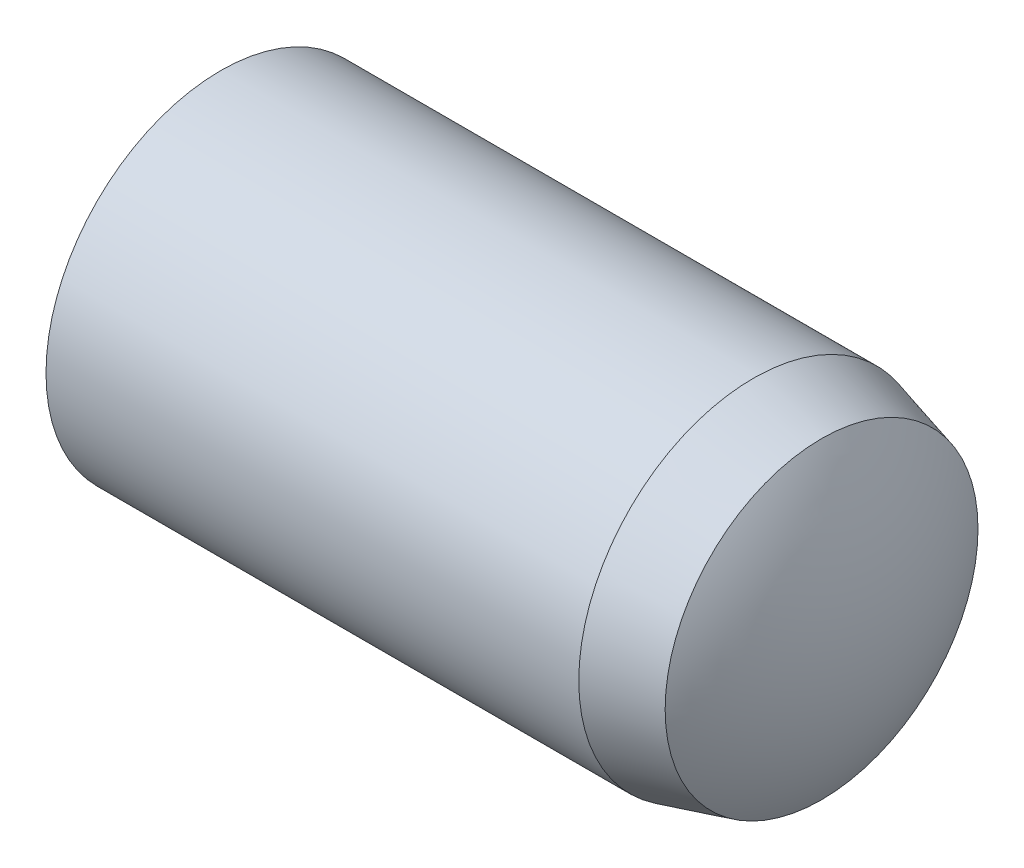
from build123d import *

# Parameters (mm, degrees)
EXTRUDE1_DEPTH      = 8
EXTRUDE1_DEPTH_BACK = 8
SKETCH2_R           = 4


with BuildPart() as part:
    # Sketch2 → Extrude1 (new, two sides: drawn at the far end of the back side and taken through both)
    with BuildSketch(Plane(origin=(0, 0, 0), x_dir=(0, 0, -1), z_dir=(1, 0, 0)).offset(-EXTRUDE1_DEPTH_BACK)):
        Circle(SKETCH2_R)
    extrude(amount=EXTRUDE1_DEPTH + EXTRUDE1_DEPTH_BACK)

    # Sketch5 → Cut-Revolve1 (revolve, cut)
    with BuildSketch(Plane.XY, mode=Mode.PRIVATE) as cut_revolve1_sk:
        with BuildLine():
            Line((5.4, 4), (5.4, 4.5))
            Line((5.4, 4.5), (8.5, 4.5))
            Line((8.5, 4.5), (8.5, 0))
            Line((8.5, 0), (8, 0))
            ThreePointArc((8, 0), (7.734740106, 1.864961038), (6.96, 3.58199926))
            Line((6.96, 3.58199926), (5.4, 4))
        make_face()
        with BuildLine():
            Line((-6.8, 4), (-6.8, 4.5))
            Line((-6.8, 4.5), (-8.5, 4.5))
            Line((-8.5, 4.5), (-8.5, 0))
            Line((-8.5, 0), (-8, 0))
            ThreePointArc((-8, 0), (-7.693537673, 2.088061302), (-6.8, 4))
        make_face()
    revolve(cut_revolve1_sk.sketch.rotate(Axis((-8, 0, 0), (1, 0, 0)), 90), axis=Axis((-8, 0, 0), (1, 0, 0)), mode=Mode.SUBTRACT)


solid = part.part
